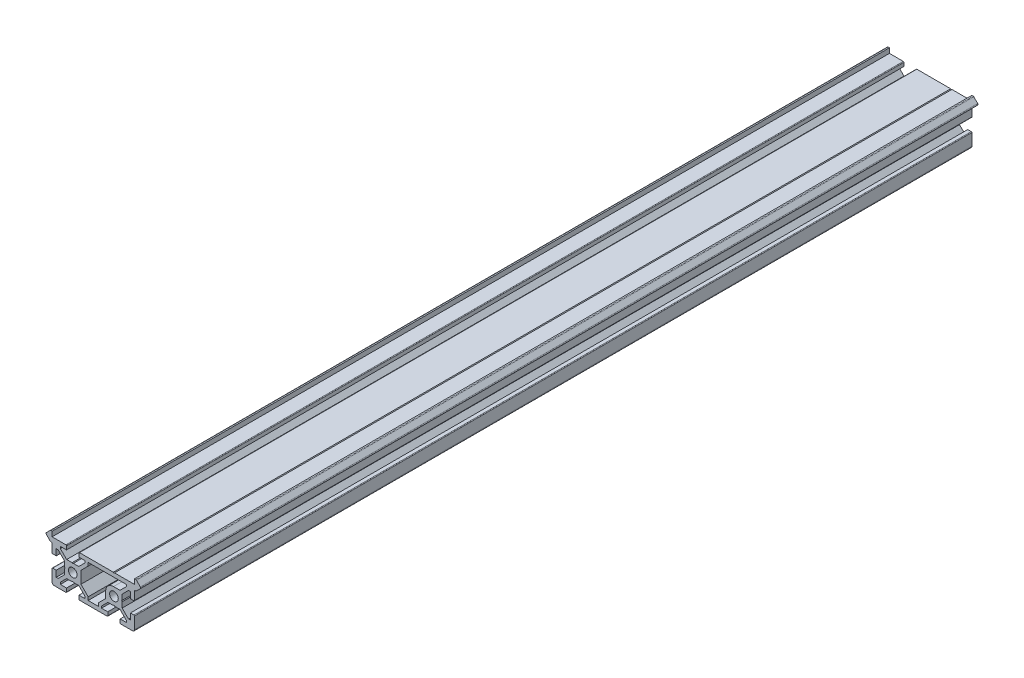
from build123d import *

# Parameters (mm, degrees)
BOSS_EXTRUDE1_START = 40
MODEL_R             = 2.100000001
BOSS_EXTRUDE1_DEPTH = 406.36


with BuildPart() as part:
    # Model → Boss-Extrude1 (new body)
    with BuildSketch(Plane.XY.offset(BOSS_EXTRUDE1_START)):
        with BuildLine():
            Line((28.771485975, 48.105572105), (30.646485975, 49.980572105))
            ThreePointArc((30.646485975, 49.980572105), (30.808697649, 50.08895848), (31.000039365, 50.127018713))
            Line((31.000039365, 50.127018713), (31.592932584, 50.127018713))
            Line((31.592932584, 50.127018713), (31.592932584, 47.752018713))
            Line((31.592932584, 47.752018713), (38.292932585, 47.752018713))
            ThreePointArc((38.292932585, 47.752018713), (38.505064619, 47.664150748), (38.592932584, 47.452018714))
            Line((38.592932584, 47.452018714), (38.592932584, 45.752018713))
            Line((38.592932584, 45.752018713), (35.592932585, 45.752018713))
            Line((35.592932585, 45.752018713), (35.592932585, 44.812678885))
            Line((35.592932585, 44.812678885), (38.653592756, 41.752018713))
            Line((38.653592756, 41.752018713), (41.292932583, 41.752018713))
            Line((41.292932583, 41.752018713), (41.592932584, 41.452018713))
            Line((41.592932584, 41.452018713), (41.892932586, 41.752018714))
            Line((41.892932586, 41.752018714), (44.532272412, 41.752018714))
            Line((44.532272412, 41.752018714), (47.592932584, 44.812678886))
            Line((47.592932584, 44.812678886), (47.592932584, 45.752018714))
            Line((47.592932584, 45.752018714), (44.592932584, 45.752018714))
            Line((44.592932584, 45.752018714), (44.592932584, 47.452018715))
            ThreePointArc((44.592932584, 47.452018715), (44.68080055, 47.664150749), (44.892932584, 47.752018715))
            Line((44.892932584, 47.752018715), (61.292932583, 47.752018715))
            Line((61.292932583, 47.752018715), (61.592932582, 47.452018715))
            Line((61.592932582, 47.452018715), (61.892932583, 47.752018716))
            Line((61.892932583, 47.752018716), (71.592932583, 47.752018716))
            Line((71.592932583, 47.752018716), (71.592932583, 50.127018711))
            Line((71.592932583, 50.127018711), (72.185825802, 50.127018711))
            ThreePointArc((72.185825802, 50.127018711), (72.377167518, 50.088958477), (72.539379192, 49.980572102))
            Line((72.539379192, 49.980572102), (74.414379192, 48.105572102))
            ThreePointArc((74.414379192, 48.105572102), (74.560825801, 47.752018712), (74.414379192, 47.398465322))
            Line((74.414379192, 47.398465322), (72.539379192, 45.523465322))
            ThreePointArc((72.539379192, 45.523465322), (72.377167518, 45.415078947), (72.185825802, 45.377018714))
            Line((72.185825802, 45.377018714), (72.092932582, 45.377018714))
            ThreePointArc((72.092932582, 45.377018714), (71.739379192, 45.230572103), (71.592932583, 44.877018713))
            Line((71.592932583, 44.877018713), (71.592932583, 41.052018712))
            ThreePointArc((71.592932583, 41.052018712), (71.505064617, 40.839886678), (71.292932581, 40.752018713))
            Line((71.292932581, 40.752018713), (69.592932583, 40.752018713))
            Line((69.592932583, 40.752018713), (69.592932583, 43.752018712))
            Line((69.592932583, 43.752018712), (68.653592755, 43.752018712))
            Line((68.653592755, 43.752018712), (65.592932583, 40.691358541))
            Line((65.592932583, 40.691358541), (65.592932583, 38.052018712))
            Line((65.592932583, 38.052018712), (65.292932584, 37.752018712))
            Line((65.292932584, 37.752018712), (65.592932583, 37.452018713))
            Line((65.592932583, 37.452018713), (65.592932583, 34.812678884))
            Line((65.592932583, 34.812678884), (68.653592755, 31.752018712))
            Line((68.653592755, 31.752018712), (69.592932583, 31.752018712))
            Line((69.592932583, 31.752018712), (69.592932583, 34.752018711))
            Line((69.592932583, 34.752018711), (71.292932581, 34.752018711))
            ThreePointArc((71.292932581, 34.752018711), (71.505064617, 34.664150747), (71.592932583, 34.452018712))
            Line((71.592932583, 34.452018712), (71.592932583, 28.75201871))
            ThreePointArc((71.592932583, 28.75201871), (71.300039364, 28.044911929), (70.592932582, 27.752018711))
            Line((70.592932582, 27.752018711), (64.892932582, 27.752018711))
            ThreePointArc((64.892932582, 27.752018711), (64.680800548, 27.839886676), (64.592932583, 28.05201871))
            Line((64.592932583, 28.05201871), (64.592932583, 29.752018711))
            Line((64.592932583, 29.752018711), (67.592932582, 29.752018711))
            Line((67.592932582, 29.752018711), (67.592932582, 30.69135854))
            Line((67.592932582, 30.69135854), (64.532272411, 33.752018711))
            Line((64.532272411, 33.752018711), (61.892932584, 33.752018711))
            Line((61.892932584, 33.752018711), (61.592932582, 34.052018713))
            Line((61.592932582, 34.052018713), (61.292932582, 33.752018712))
            Line((61.292932582, 33.752018712), (58.653592755, 33.752018712))
            Line((58.653592755, 33.752018712), (55.592932583, 30.691358541))
            Line((55.592932583, 30.691358541), (55.592932583, 29.752018713))
            Line((55.592932583, 29.752018713), (58.592932583, 29.752018713))
            Line((58.592932583, 29.752018713), (58.592932583, 28.052018712))
            ThreePointArc((58.592932583, 28.052018712), (58.505064617, 27.839886678), (58.292932583, 27.752018712))
            Line((58.292932583, 27.752018712), (44.892932584, 27.752018712))
            ThreePointArc((44.892932584, 27.752018712), (44.68080055, 27.839886678), (44.592932584, 28.052018712))
            Line((44.592932584, 28.052018712), (44.592932584, 29.752018713))
            Line((44.592932584, 29.752018713), (47.592932584, 29.752018713))
            Line((47.592932584, 29.752018713), (47.592932584, 30.691358541))
            Line((47.592932584, 30.691358541), (44.532272412, 33.752018712))
            Line((44.532272412, 33.752018712), (41.892932586, 33.752018712))
            Line((41.892932586, 33.752018712), (41.592932584, 34.052018714))
            Line((41.592932584, 34.052018714), (41.292932583, 33.752018714))
            Line((41.292932583, 33.752018714), (38.653592756, 33.752018714))
            Line((38.653592756, 33.752018714), (35.592932585, 30.691358542))
            Line((35.592932585, 30.691358542), (35.592932585, 29.752018714))
            Line((35.592932585, 29.752018714), (38.592932584, 29.752018714))
            Line((38.592932584, 29.752018714), (38.592932584, 28.052018713))
            ThreePointArc((38.592932584, 28.052018713), (38.505064619, 27.839886679), (38.292932585, 27.752018714))
            Line((38.292932585, 27.752018714), (32.592932585, 27.752018714))
            ThreePointArc((32.592932585, 27.752018714), (31.885825803, 28.044911931), (31.592932584, 28.752018713))
            Line((31.592932584, 28.752018713), (31.592932584, 34.452018715))
            ThreePointArc((31.592932584, 34.452018715), (31.68080055, 34.664150748), (31.892932583, 34.752018714))
            Line((31.892932583, 34.752018714), (33.592932584, 34.752018714))
            Line((33.592932584, 34.752018714), (33.592932584, 31.752018715))
            Line((33.592932584, 31.752018715), (34.532272412, 31.752018715))
            Line((34.532272412, 31.752018715), (37.592932584, 34.812678886))
            Line((37.592932584, 34.812678886), (37.592932584, 37.452018715))
            Line((37.592932584, 37.452018715), (37.892932583, 37.752018715))
            Line((37.892932583, 37.752018715), (37.592932584, 38.052018714))
            Line((37.592932584, 38.052018714), (37.592932584, 40.691358543))
            Line((37.592932584, 40.691358543), (34.532272412, 43.752018715))
            Line((34.532272412, 43.752018715), (33.592932584, 43.752018715))
            Line((33.592932584, 43.752018715), (33.592932584, 40.752018716))
            Line((33.592932584, 40.752018716), (31.892932586, 40.752018716))
            ThreePointArc((31.892932586, 40.752018716), (31.68080055, 40.83988668), (31.592932584, 41.052018715))
            Line((31.592932584, 41.052018715), (31.592932584, 44.877018715))
            ThreePointArc((31.592932584, 44.877018715), (31.446485975, 45.230572106), (31.092932585, 45.377018716))
            Line((31.092932585, 45.377018716), (31.000039365, 45.377018716))
            ThreePointArc((31.000039365, 45.377018716), (30.808697649, 45.41507895), (30.646485975, 45.523465324))
            Line((30.646485975, 45.523465324), (28.771485975, 47.398465325))
            ThreePointArc((28.771485975, 47.398465325), (28.625039366, 47.752018715), (28.771485975, 48.105572105))
        make_face()
        with Locations((61.592932582, 37.752018715)):
            Circle(MODEL_R, mode=Mode.SUBTRACT)
        with Locations((41.592932582, 37.752018715)):
            Circle(MODEL_R, mode=Mode.SUBTRACT)
        with BuildLine():
            Line((54.092932584, 29.752018715), (49.092932584, 29.752018715))
            Line((49.092932584, 29.752018715), (49.092932584, 31.312678886))
            Line((49.092932584, 31.312678886), (45.592932583, 34.812678886))
            Line((45.592932583, 34.812678886), (45.592932583, 40.691358543))
            Line((45.592932583, 40.691358543), (49.092932584, 44.191358544))
            Line((49.092932584, 44.191358544), (49.092932584, 45.752018714))
            Line((49.092932584, 45.752018714), (67.592932582, 45.752018714))
            Line((67.592932582, 45.752018714), (67.592932582, 44.812678887))
            Line((67.592932582, 44.812678887), (64.532272411, 41.752018716))
            Line((64.532272411, 41.752018716), (61.402932584, 41.752018716))
            ThreePointArc((61.402932584, 41.752018716), (58.708855747, 40.636095552), (57.592932584, 37.942018716))
            Line((57.592932584, 37.942018716), (57.592932584, 34.812678886))
            Line((57.592932584, 34.812678886), (54.092932584, 31.312678886))
            Line((54.092932584, 31.312678886), (54.092932584, 29.752018715))
        make_face(mode=Mode.SUBTRACT)
    extrude(amount=BOSS_EXTRUDE1_DEPTH)


solid = part.part
